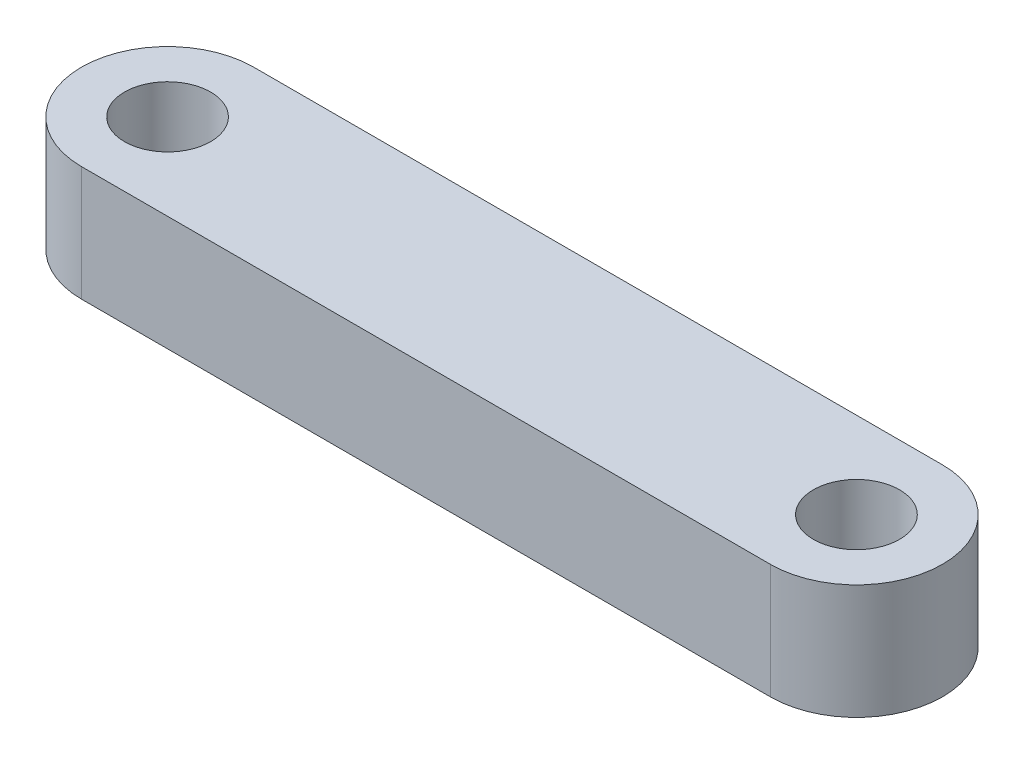
from build123d import *

# Parameters (mm, degrees)
SKETCH_1_R      = 1.5
EXTRUDE_1_DEPTH = 4


with BuildPart() as part:
    # 草图1 → 凸台-拉伸1 (new body)
    with BuildSketch(Plane(origin=(0, 0, 0), x_dir=(1, 0, 0), z_dir=(0, 1, 0))):
        with BuildLine():
            Line((0, 3), (24, 3))
            ThreePointArc((24, 3), (27, 0), (24, -3))
            Line((24, -3), (0, -3))
            ThreePointArc((0, -3), (-3, 0), (0, 3))
        make_face()
        with Locations(Location((0, 0, 0), (0, 0, 270))):
            Circle(SKETCH_1_R, mode=Mode.SUBTRACT)
        with Locations(Location((24, 0, 0), (0, 0, 270))):
            Circle(SKETCH_1_R, mode=Mode.SUBTRACT)
    extrude(amount=EXTRUDE_1_DEPTH)


solid = part.part
